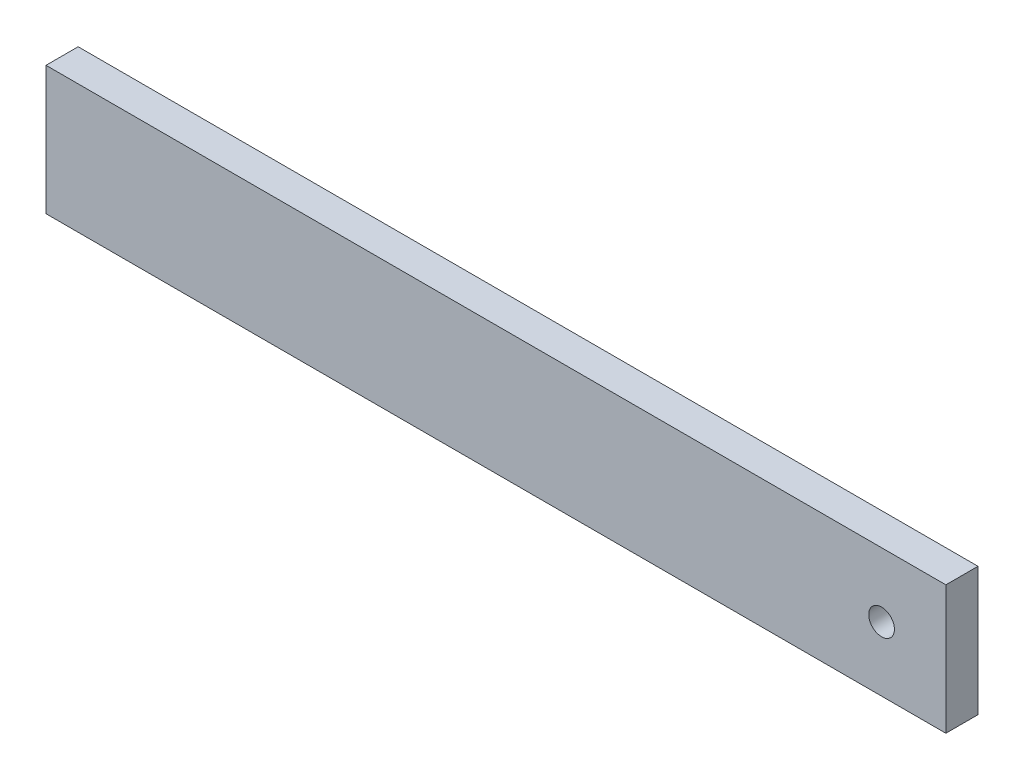
from build123d import *

# Parameters (mm, degrees)
ESQUISSE1_W        = 140
ESQUISSE1_H        = 20
ESQUISSE1_R        = 2
BOSS_EXTRU_1_DEPTH = 5


with BuildPart() as part:
    # Esquisse1 → Boss.-Extru.1 (new body)
    with BuildSketch(Plane.XY):
        with Locations((-70, 10)):
            Rectangle(ESQUISSE1_W, ESQUISSE1_H)
        with Locations((-10, 10)):
            Circle(ESQUISSE1_R, mode=Mode.SUBTRACT)
    extrude(amount=BOSS_EXTRU_1_DEPTH)


solid = part.part
